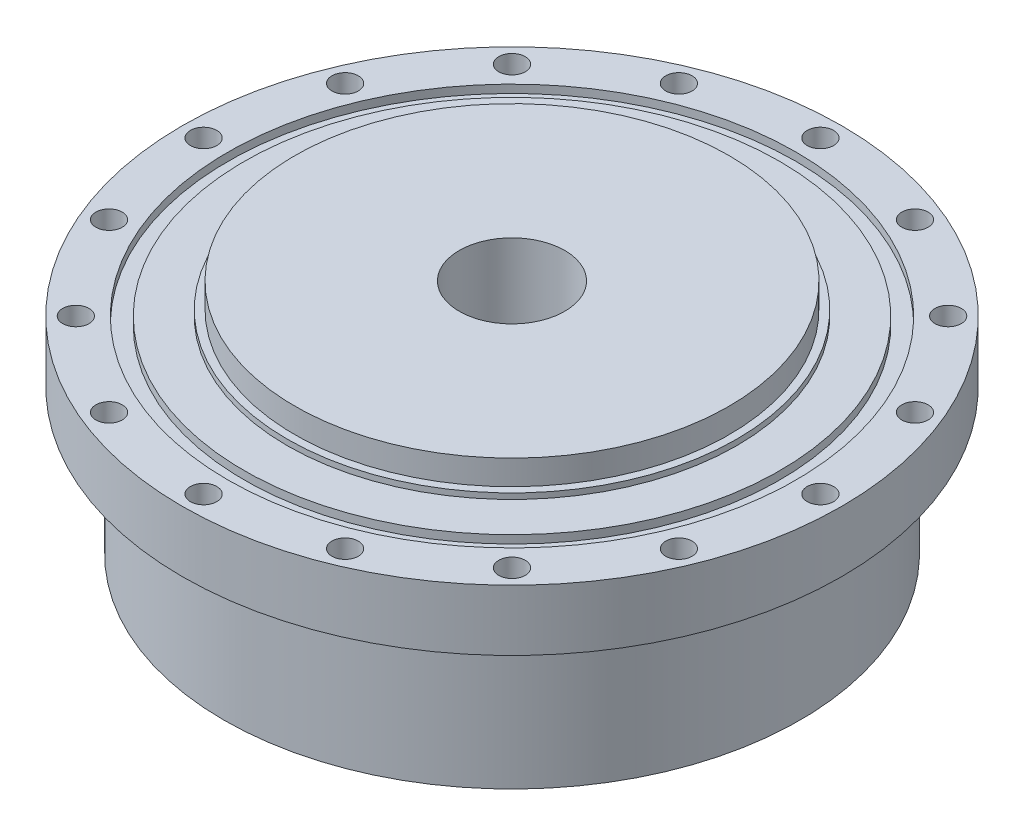
from build123d import *

# Parameters (mm, degrees)
SKETCH2_R          = 5
SKETCH2_R_2        = 8
CUT_EXTRUDE1_DEPTH = 20
SKETCH3_R          = 6.5
CUT_EXTRUDE2_DEPTH = 40
CUT_EXTRUDE3_START = -3
SKETCH4_R          = 122.5
CUT_EXTRUDE3_DEPTH = 3


with BuildPart() as part:
    # Sketch1 → Revolve1 (revolve)
    with BuildSketch(Plane.XY, mode=Mode.PRIVATE) as revolve1_sk:
        Polygon((0, 0), (-122.5, 0), (-122.5, 8.5), (-142, 8.5), (-142, 80), (-162.5, 80), (-162.5, 110), (-140, 110), (-140, 106), (-132, 106), (-132, 110), (-110.75, 110), (-110.75, 112.8), (-107, 112.8), (-107, 125), (-26, 125), (-26, 65), (0, 65), align=None)
    revolve(revolve1_sk.sketch.rotate(Axis((0, 0, 0), (0, 1, 0)), 270), axis=Axis((0, 0, 0), (0, 1, 0)))

    # Sketch2 → Cut-Extrude1 (cut)
    with BuildSketch(Plane.XZ):
        with Locations(Location((-111.280047836, -12.678759942, 0), (0, 0, 270))):
            Circle(SKETCH2_R)
        with Locations(Location((-111.280047836, 12.678759942, 0), (0, 0, 270))):
            Circle(SKETCH2_R)
        with Locations(Location((-105.575847002, 37.386368234, 0), (0, 0, 270))):
            Circle(SKETCH2_R)
        with Locations(Location((-94.459841931, 60.177556135, 0), (0, 0, 270))):
            Circle(SKETCH2_R)
        with Locations(Location((-105.575847002, -37.386368234, 0), (0, 0, 270))):
            Circle(SKETCH2_R)
        with Locations(Location((-94.459841931, -60.177556135, 0), (0, 0, 270))):
            Circle(SKETCH2_R)
        with Locations(Location((99.345213316, 51.715844682, 0), (0, 0, 270))):
            Circle(SKETCH2_R)
        with Locations(Location((85.165468147, 72.738181413, 0), (0, 0, 270))):
            Circle(SKETCH2_R)
        with Locations(Location((66.620152116, 90.031968389, 0), (0, 0, 270))):
            Circle(SKETCH2_R)
        with Locations(Location((44.65989572, 102.710728331, 0), (0, 0, 270))):
            Circle(SKETCH2_R)
        with Locations(Location((20.410378855, 110.124549647, 0), (0, 0, 270))):
            Circle(SKETCH2_R)
        with Locations(Location((-4.885371385, 111.893400817, 0), (0, 0, 270))):
            Circle(SKETCH2_R)
        with Locations(Location((-4.885371385, -111.893400817, 0), (0, 0, 270))):
            Circle(SKETCH2_R)
        with Locations(Location((20.410378855, -110.124549647, 0), (0, 0, 270))):
            Circle(SKETCH2_R)
        with Locations(Location((44.65989572, -102.710728331, 0), (0, 0, 270))):
            Circle(SKETCH2_R)
        with Locations(Location((66.620152116, -90.031968389, 0), (0, 0, 270))):
            Circle(SKETCH2_R)
        with Locations(Location((85.165468147, -72.738181413, 0), (0, 0, 270))):
            Circle(SKETCH2_R)
        with Locations(Location((99.345213316, -51.715844682, 0), (0, 0, 270))):
            Circle(SKETCH2_R)
        with Locations(Location((-84.693466759, 14.933743279, 0), (0, 0, 270))):
            Circle(SKETCH2_R_2)
        with Locations(Location((-84.693466759, -14.933743279, 0), (0, 0, 270))):
            Circle(SKETCH2_R_2)
        with Locations(Location((55.279734433, 65.879822108, 0), (0, 0, 270))):
            Circle(SKETCH2_R_2)
        with Locations(Location((29.413732326, 80.813565388, 0), (0, 0, 270))):
            Circle(SKETCH2_R_2)
        with Locations(Location((29.413732326, -80.813565388, 0), (0, 0, 270))):
            Circle(SKETCH2_R_2)
        with Locations(Location((55.279734433, -65.879822108, 0), (0, 0, 270))):
            Circle(SKETCH2_R_2)
    extrude(amount=-CUT_EXTRUDE1_DEPTH, mode=Mode.SUBTRACT)

    # Sketch3 → Cut-Extrude2 (cut)
    with BuildSketch(Plane.XZ.offset(-80)):
        with Locations(Location((0, 152, 0), (0, 0, 270))):
            Circle(SKETCH3_R)
        with Locations(Location((58.167881719, 140.429688942, 0), (0, 0, 270))):
            Circle(SKETCH3_R)
        with Locations(Location((107.48023074, 107.48023074, 0), (0, 0, 270))):
            Circle(SKETCH3_R)
        with Locations(Location((140.429688942, 58.167881719, 0), (0, 0, 270))):
            Circle(SKETCH3_R)
        with Locations(Location((152, 0, 0), (0, 0, 270))):
            Circle(SKETCH3_R)
        with Locations(Location((140.429688942, -58.167881719, 0), (0, 0, 270))):
            Circle(SKETCH3_R)
        with Locations(Location((107.48023074, -107.48023074, 0), (0, 0, 270))):
            Circle(SKETCH3_R)
        with Locations(Location((58.167881719, -140.429688942, 0), (0, 0, 270))):
            Circle(SKETCH3_R)
        with Locations(Location((0, -152, 0), (0, 0, 270))):
            Circle(SKETCH3_R)
        with Locations(Location((-58.167881719, -140.429688942, 0), (0, 0, 270))):
            Circle(SKETCH3_R)
        with Locations(Location((-107.48023074, -107.48023074, 0), (0, 0, 270))):
            Circle(SKETCH3_R)
        with Locations(Location((-140.429688942, -58.167881719, 0), (0, 0, 270))):
            Circle(SKETCH3_R)
        with Locations(Location((-152, 0, 0), (0, 0, 270))):
            Circle(SKETCH3_R)
        with Locations(Location((-140.429688942, 58.167881719, 0), (0, 0, 270))):
            Circle(SKETCH3_R)
        with Locations(Location((-107.48023074, 107.48023074, 0), (0, 0, 270))):
            Circle(SKETCH3_R)
        with Locations(Location((-58.167881719, 140.429688942, 0), (0, 0, 270))):
            Circle(SKETCH3_R)
    extrude(amount=-CUT_EXTRUDE2_DEPTH, mode=Mode.SUBTRACT)

    # Sketch4 → Cut-Extrude3 (cut)
    with BuildSketch(Plane.XZ.offset(CUT_EXTRUDE3_START)):
        with Locations(Location((0, 0, 0), (0, 0, 270))):
            Circle(SKETCH4_R)
        with BuildLine():
            ThreePointArc((20.232592114, 60.717725718), (-58.25, 100.891959541), (-62.699388989, 12.836924104))
            ThreePointArc((-62.699388989, 12.836924104), (-64, 0), (-62.699388989, -12.836924104))
            ThreePointArc((-62.699388989, -12.836924104), (-58.25, -100.891959541), (20.232592114, -60.717725718))
            ThreePointArc((20.232592114, -60.717725718), (32, -55.425625842), (42.466796875, -47.880801614))
            ThreePointArc((42.466796875, -47.880801614), (116.5, 0), (42.466796875, 47.880801614))
            ThreePointArc((42.466796875, 47.880801614), (32, 55.425625842), (20.232592114, 60.717725718))
        make_face(mode=Mode.SUBTRACT)
    extrude(amount=CUT_EXTRUDE3_DEPTH, mode=Mode.SUBTRACT)


solid = part.part
